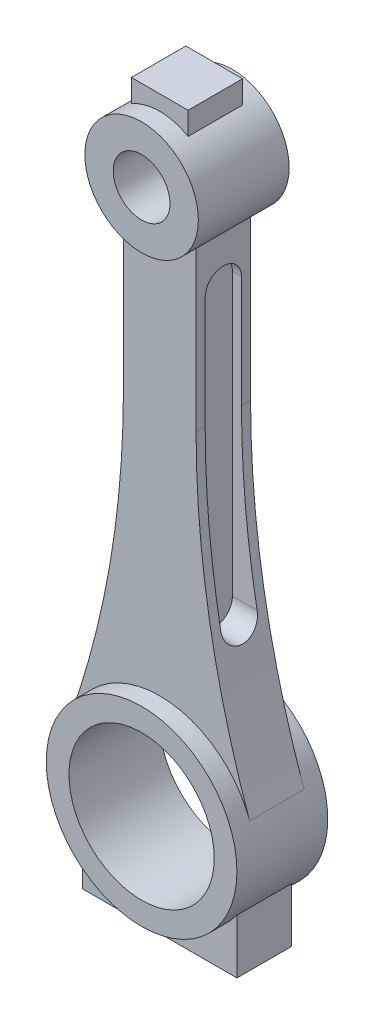
from build123d import *

# Parameters (mm, degrees)
SKETCH1_R             = 21
SKETCH1_R_2           = 16
BOSS_EXTRUDE1_DEPTH   = 10
SKETCH1_R_3           = 12.5
SKETCH1_R_4           = 6.25
BOSS_EXTRUDE1_2_DEPTH = 10
BOSS_EXTRUDE3_DEPTH   = 6
CUT_EXTRUDE1_START    = -6
CUT_EXTRUDE1_DEPTH    = 132.802456026


with BuildPart() as part:
    # Sketch1 → Boss-Extrude1 (new, symmetric)
    with BuildSketch(Plane.XY):
        Circle(SKETCH1_R)
        Circle(SKETCH1_R_2, mode=Mode.SUBTRACT)
    extrude(amount=BOSS_EXTRUDE1_DEPTH, both=True)



with BuildPart() as body_2:
    # Sketch1 → Boss-Extrude1 2 (new, symmetric)
    with BuildSketch(Plane.XY):
        with Locations((0, 120)):
            Circle(SKETCH1_R_3)
        with Locations((0, 120)):
            Circle(SKETCH1_R_4, mode=Mode.SUBTRACT)
    extrude(amount=BOSS_EXTRUDE1_2_DEPTH, both=True)


with BuildPart() as part_1:
    add(part.part)

    add(body_2.part)  # Boss-Extrude3 merges body 2
    # Sketch1<4> → Boss-Extrude3 (add, symmetric)
    with BuildSketch(Plane.XY):
        with BuildLine():
            Line((-8, 110.395313644), (-8, 75.395313644))
            ThreePointArc((-8, 75.395313644), (-10.96842855, 40.709642053), (-19.787382488, 7.032744434))
            ThreePointArc((-19.787382488, 7.032744434), (0, 21), (19.787382488, 7.032744434))
            ThreePointArc((19.787382488, 7.032744434), (10.96842855, 40.709642053), (8, 75.395313644))
            Line((8, 75.395313644), (8, 110.395313644))
            ThreePointArc((8, 110.395313644), (0, 107.5), (-8, 110.395313644))
        make_face()
        with BuildLine():
            Line((-6.25, 135.825317547), (-6.25, 130.825317547))
            ThreePointArc((-6.25, 130.825317547), (0, 132.5), (6.25, 130.825317547))
            Line((6.25, 130.825317547), (6.25, 135.825317547))
            Line((6.25, 135.825317547), (-6.25, 135.825317547))
        make_face()
        with BuildLine():
            ThreePointArc((17, -12.328828006), (0, -21), (-17, -12.328828006))
            Line((-17, -12.328828006), (-17, -24.328828006))
            Line((-17, -24.328828006), (17, -24.328828006))
            Line((17, -24.328828006), (17, -12.328828006))
        make_face()
    extrude(amount=BOSS_EXTRUDE3_DEPTH, both=True)

    # Sketch3 → Cut-Extrude1 (cut, through all)
    with BuildSketch(Plane(origin=(0, 0, 0), x_dir=(0, 0, -1), z_dir=(1, 0, 0)).offset(CUT_EXTRUDE1_START)):
        with BuildLine():
            Line((4, 100), (4, 38))
            ThreePointArc((4, 38), (0, 34), (-4, 38))
            Line((-4, 38), (-4, 100))
            ThreePointArc((-4, 100), (0, 104), (4, 100))
        make_face()
    cut_extrude1 = extrude(amount=-CUT_EXTRUDE1_DEPTH, mode=Mode.SUBTRACT)

    # Mirror1: Cut-Extrude1 across plane
    add(cut_extrude1.mirror(Plane(origin=(0, 0, 0), x_dir=(0, 0, 1), z_dir=(1, 0, 0))), mode=Mode.SUBTRACT)


solid = part_1.part
